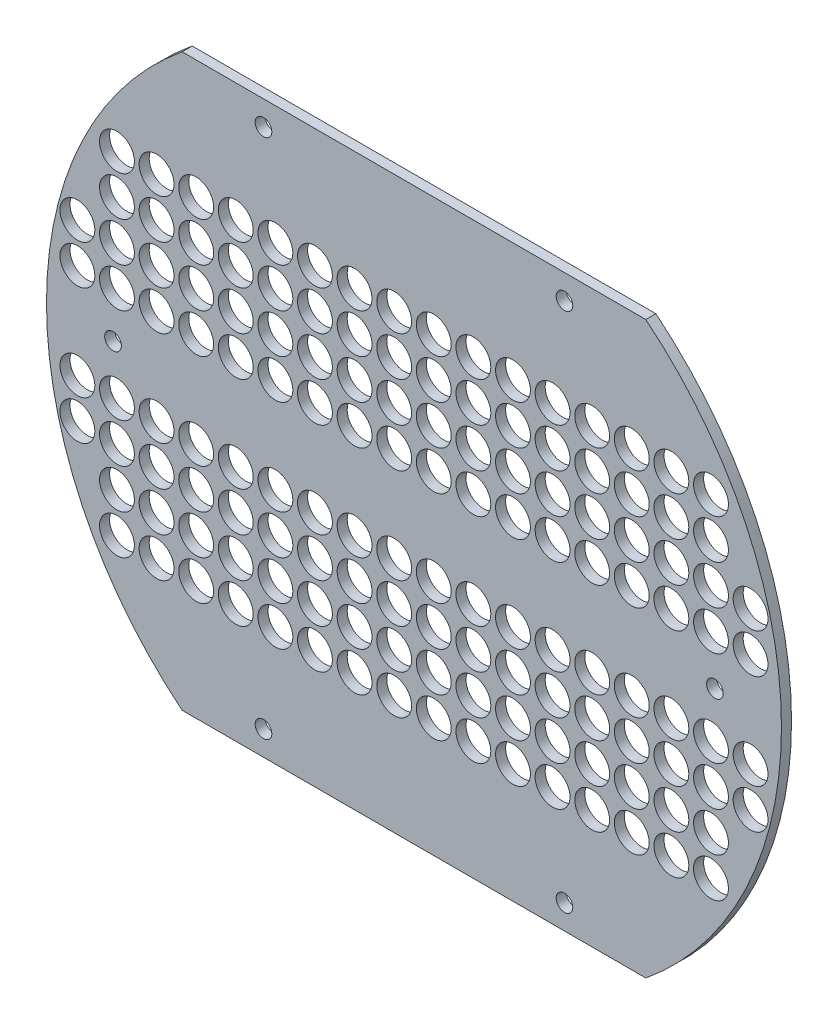
from build123d import *

# Parameters (mm, degrees)
BOSS_EXTRUDE1_DEPTH                        = 6.35
SKETCH2_R                                  = 5.25
CUT_EXTRUDE1_DEPTH                         = 294.707886343
SKETCH3_R                                  = 11
CUT_EXTRUDE2_DEPTH                         = 294.707886343
MIRROR2_AT_THE_SECOND_PLANE_COPY_1_SKETC_R = 11
MIRROR2_AT_THE_SECOND_PLANE_COPY_1_DEPTH   = 294.707886343


with BuildPart() as part:
    # Sketch1 → Boss-Extrude1 (new body)
    with BuildSketch(Plane.XY):
        with BuildLine():
            Line((-146.369395708, 180), (146.369395708, 180))
            ThreePointArc((146.369395708, 180), (232, 0), (146.369395708, -180))
            Line((146.369395708, -180), (-146.369395708, -180))
            ThreePointArc((-146.369395708, -180), (-232, 0), (-146.369395708, 180))
        make_face()
    extrude(amount=BOSS_EXTRUDE1_DEPTH)

    # Sketch2 → Cut-Extrude1 (cut, through all)
    with BuildSketch(Plane.XY.offset(6.35)):
        with Locations((-190, 0)):
            Circle(SKETCH2_R)
        with Locations((-95, 164.544826719)):
            Circle(SKETCH2_R)
        with Locations((95, 164.544826719)):
            Circle(SKETCH2_R)
        with Locations((190, 0)):
            Circle(SKETCH2_R)
        with Locations((95, -164.544826719)):
            Circle(SKETCH2_R)
        with Locations((-95, -164.544826719)):
            Circle(SKETCH2_R)
    extrude(amount=-CUT_EXTRUDE1_DEPTH, mode=Mode.SUBTRACT)

    # Sketch3 → Cut-Extrude2 (cut, through all)
    with BuildSketch(Plane.XY.offset(6.35)):
        with Locations((12.5, -30)):
            Circle(SKETCH3_R)
        with Locations((12.5, -55)):
            Circle(SKETCH3_R)
        with Locations((12.5, -80)):
            Circle(SKETCH3_R)
        with Locations((12.5, -105)):
            Circle(SKETCH3_R)
        with Locations((37.5, -30)):
            Circle(SKETCH3_R)
        with Locations((37.5, -55)):
            Circle(SKETCH3_R)
        with Locations((62.5, -30)):
            Circle(SKETCH3_R)
        with Locations((62.5, -55)):
            Circle(SKETCH3_R)
        with Locations((87.5, -30)):
            Circle(SKETCH3_R)
        with Locations((87.5, -55)):
            Circle(SKETCH3_R)
        with Locations((112.5, -30)):
            Circle(SKETCH3_R)
        with Locations((112.5, -55)):
            Circle(SKETCH3_R)
        with Locations((137.5, -30)):
            Circle(SKETCH3_R)
        with Locations((137.5, -55)):
            Circle(SKETCH3_R)
        with Locations((162.5, -30)):
            Circle(SKETCH3_R)
        with Locations((162.5, -55)):
            Circle(SKETCH3_R)
        with Locations((187.5, -30)):
            Circle(SKETCH3_R)
        with Locations((187.5, -55)):
            Circle(SKETCH3_R)
        with Locations((212.5, -30)):
            Circle(SKETCH3_R)
        with Locations((212.5, -55)):
            Circle(SKETCH3_R)
        with Locations((37.5, -80)):
            Circle(SKETCH3_R)
        with Locations((37.5, -105)):
            Circle(SKETCH3_R)
        with Locations((62.5, -80)):
            Circle(SKETCH3_R)
        with Locations((62.5, -105)):
            Circle(SKETCH3_R)
        with Locations((87.5, -80)):
            Circle(SKETCH3_R)
        with Locations((87.5, -105)):
            Circle(SKETCH3_R)
        with Locations((112.5, -80)):
            Circle(SKETCH3_R)
        with Locations((112.5, -105)):
            Circle(SKETCH3_R)
        with Locations((137.5, -80)):
            Circle(SKETCH3_R)
        with Locations((137.5, -105)):
            Circle(SKETCH3_R)
        with Locations((162.5, -80)):
            Circle(SKETCH3_R)
        with Locations((162.5, -105)):
            Circle(SKETCH3_R)
        with Locations((187.5, -80)):
            Circle(SKETCH3_R)
        with Locations((187.5, -105)):
            Circle(SKETCH3_R)
    cut_extrude2 = extrude(amount=-CUT_EXTRUDE2_DEPTH, mode=Mode.SUBTRACT)

    # Mirror2: Cut-Extrude2 across plane
    add(cut_extrude2.mirror(Plane.ZX), mode=Mode.SUBTRACT)

    # Mirror2 at the second plane: Cut-Extrude2 across plane
    add(cut_extrude2.mirror(Plane(origin=(0, 0, 0), x_dir=(0, 0, 1), z_dir=(1, 0, 0))), mode=Mode.SUBTRACT)

    # Mirror2 at the second plane copy 1 sketc → Mirror2 at the second plane copy 1 (cut, through all)
    with BuildSketch(Plane(origin=(0, 0, 6.35), x_dir=(-1, 0, 0), z_dir=(0, 0, 1))):
        with Locations((12.5, -30)):
            Circle(MIRROR2_AT_THE_SECOND_PLANE_COPY_1_SKETC_R)
        with Locations((12.5, -55)):
            Circle(MIRROR2_AT_THE_SECOND_PLANE_COPY_1_SKETC_R)
        with Locations((12.5, -80)):
            Circle(MIRROR2_AT_THE_SECOND_PLANE_COPY_1_SKETC_R)
        with Locations((12.5, -105)):
            Circle(MIRROR2_AT_THE_SECOND_PLANE_COPY_1_SKETC_R)
        with Locations((37.5, -30)):
            Circle(MIRROR2_AT_THE_SECOND_PLANE_COPY_1_SKETC_R)
        with Locations((37.5, -55)):
            Circle(MIRROR2_AT_THE_SECOND_PLANE_COPY_1_SKETC_R)
        with Locations((62.5, -30)):
            Circle(MIRROR2_AT_THE_SECOND_PLANE_COPY_1_SKETC_R)
        with Locations((62.5, -55)):
            Circle(MIRROR2_AT_THE_SECOND_PLANE_COPY_1_SKETC_R)
        with Locations((87.5, -30)):
            Circle(MIRROR2_AT_THE_SECOND_PLANE_COPY_1_SKETC_R)
        with Locations((87.5, -55)):
            Circle(MIRROR2_AT_THE_SECOND_PLANE_COPY_1_SKETC_R)
        with Locations((112.5, -30)):
            Circle(MIRROR2_AT_THE_SECOND_PLANE_COPY_1_SKETC_R)
        with Locations((112.5, -55)):
            Circle(MIRROR2_AT_THE_SECOND_PLANE_COPY_1_SKETC_R)
        with Locations((137.5, -30)):
            Circle(MIRROR2_AT_THE_SECOND_PLANE_COPY_1_SKETC_R)
        with Locations((137.5, -55)):
            Circle(MIRROR2_AT_THE_SECOND_PLANE_COPY_1_SKETC_R)
        with Locations((162.5, -30)):
            Circle(MIRROR2_AT_THE_SECOND_PLANE_COPY_1_SKETC_R)
        with Locations((162.5, -55)):
            Circle(MIRROR2_AT_THE_SECOND_PLANE_COPY_1_SKETC_R)
        with Locations((187.5, -30)):
            Circle(MIRROR2_AT_THE_SECOND_PLANE_COPY_1_SKETC_R)
        with Locations((187.5, -55)):
            Circle(MIRROR2_AT_THE_SECOND_PLANE_COPY_1_SKETC_R)
        with Locations((212.5, -30)):
            Circle(MIRROR2_AT_THE_SECOND_PLANE_COPY_1_SKETC_R)
        with Locations((212.5, -55)):
            Circle(MIRROR2_AT_THE_SECOND_PLANE_COPY_1_SKETC_R)
        with Locations((37.5, -80)):
            Circle(MIRROR2_AT_THE_SECOND_PLANE_COPY_1_SKETC_R)
        with Locations((37.5, -105)):
            Circle(MIRROR2_AT_THE_SECOND_PLANE_COPY_1_SKETC_R)
        with Locations((62.5, -80)):
            Circle(MIRROR2_AT_THE_SECOND_PLANE_COPY_1_SKETC_R)
        with Locations((62.5, -105)):
            Circle(MIRROR2_AT_THE_SECOND_PLANE_COPY_1_SKETC_R)
        with Locations((87.5, -80)):
            Circle(MIRROR2_AT_THE_SECOND_PLANE_COPY_1_SKETC_R)
        with Locations((87.5, -105)):
            Circle(MIRROR2_AT_THE_SECOND_PLANE_COPY_1_SKETC_R)
        with Locations((112.5, -80)):
            Circle(MIRROR2_AT_THE_SECOND_PLANE_COPY_1_SKETC_R)
        with Locations((112.5, -105)):
            Circle(MIRROR2_AT_THE_SECOND_PLANE_COPY_1_SKETC_R)
        with Locations((137.5, -80)):
            Circle(MIRROR2_AT_THE_SECOND_PLANE_COPY_1_SKETC_R)
        with Locations((137.5, -105)):
            Circle(MIRROR2_AT_THE_SECOND_PLANE_COPY_1_SKETC_R)
        with Locations((162.5, -80)):
            Circle(MIRROR2_AT_THE_SECOND_PLANE_COPY_1_SKETC_R)
        with Locations((162.5, -105)):
            Circle(MIRROR2_AT_THE_SECOND_PLANE_COPY_1_SKETC_R)
        with Locations((187.5, -80)):
            Circle(MIRROR2_AT_THE_SECOND_PLANE_COPY_1_SKETC_R)
        with Locations((187.5, -105)):
            Circle(MIRROR2_AT_THE_SECOND_PLANE_COPY_1_SKETC_R)
    extrude(amount=-MIRROR2_AT_THE_SECOND_PLANE_COPY_1_DEPTH, mode=Mode.SUBTRACT)


solid = part.part
